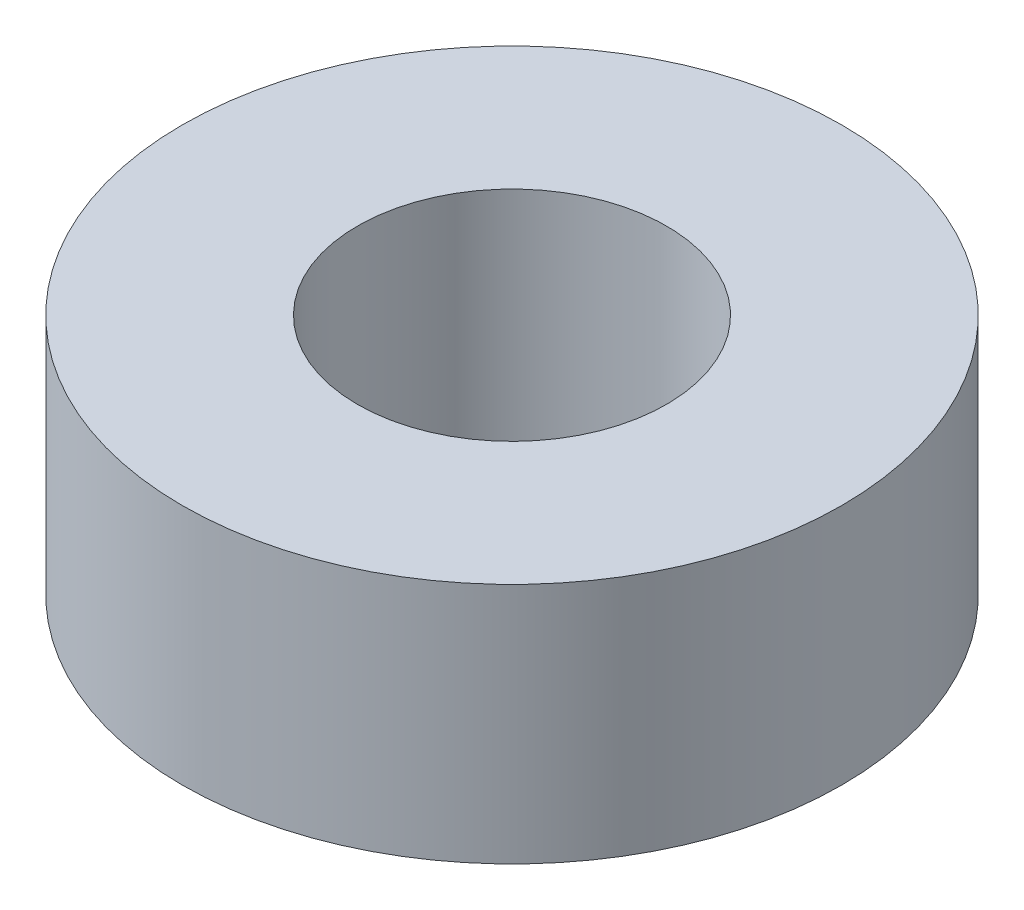
from build123d import *

# Parameters (mm, degrees)
SKETCH1_R           = 3.2
SKETCH1_R_2         = 1.5
BOSS_EXTRUDE1_DEPTH = 2.35


with BuildPart() as part:
    # Sketch1 → Boss-Extrude1 (new body)
    with BuildSketch(Plane(origin=(0, 0, 0), x_dir=(1, 0, 0), z_dir=(0, 1, 0))):
        with Locations(Location((0, 0, 0), (0, 0, 270))):
            Circle(SKETCH1_R)
        with Locations(Location((0, 0, 0), (0, 0, 270))):
            Circle(SKETCH1_R_2, mode=Mode.SUBTRACT)
    extrude(amount=BOSS_EXTRUDE1_DEPTH)


solid = part.part
